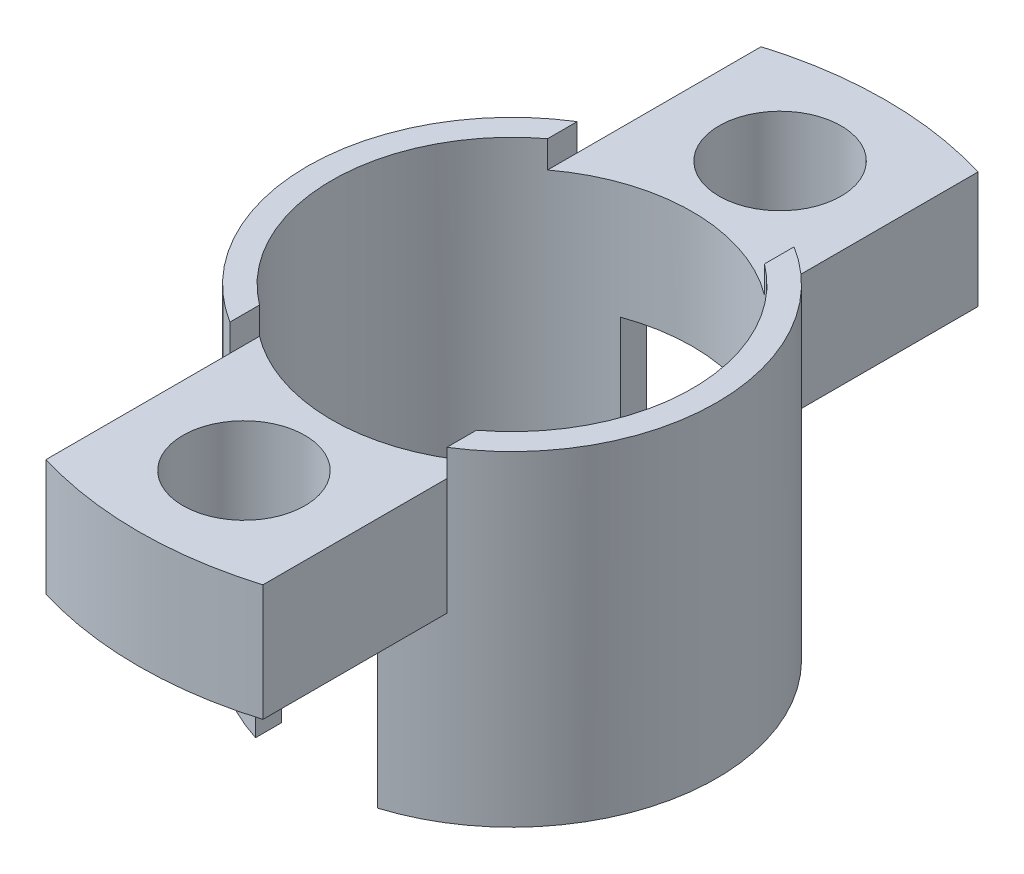
from build123d import *
from build123d.topology import SkipClean

# Parameters (mm, degrees)
SKETCH2_R                              = 6.55
SKETCH2_R_2                            = 5.8
MIDDLE_CORE_DEPTH                      = 6
ARMS_INSERT_FIXING_START               = -4.3
SKETCH3_R                              = 2.25
SKETCH3_R_2                            = 5.8
ARMS_INSERT_FIXING_TO_GUIDE_PART_DEPTH = 4.3
BOSS_EXTRU_1_REACH                     = 18.395
ESQUISSE2_R                            = 7.55
ESQUISSE2_R_2                          = 6.55
BOSS_EXTRU_2_START                     = 6
ESQUISSE3_R                            = 7.55
ESQUISSE3_R_2                          = 6.65
BOSS_EXTRU_2_DEPTH                     = 6
CUT_EXTRUDE3_START                     = -6.7
SKETCH26_W                             = 4.5
SKETCH26_H                             = 19.773523992
CUT_EXTRUDE3_DEPTH                     = 6.7
BOSS_EXTRUDE2_START                    = -1
SKETCH27_R                             = 7.55
SKETCH27_R_2                           = 6.55
BOSS_EXTRUDE2_DEPTH                    = 1
SKETCH28_W                             = 8
SKETCH28_H                             = 17.546667572
CUT_EXTRUDE4_DEPTH                     = 1
SKETCH29_R                             = 6.65
CUT_EXTRUDE5_DEPTH                     = 10


with BuildPart() as part:
    # Sketch2 → Middle-core (new body)
    with BuildSketch(Plane(origin=(0, 0, 0), x_dir=(1, 0, 0), z_dir=(0, 1, 0))):
        with Locations(Location((0, 0, 0), (0, 0, 270))):
            Circle(SKETCH2_R)
        with Locations(Location((0, 0, 0), (0, 0, 270))):
            Circle(SKETCH2_R_2, mode=Mode.SUBTRACT)
    extrude(amount=MIDDLE_CORE_DEPTH)

    # Sketch3 → Arms_insert-Fixing to guide part (add)
    with SkipClean():  # the faces are left unmerged after this step: merging them gives an invalid solid
        with BuildSketch(Plane(origin=(0, 5, 0), x_dir=(1, 0, 0), z_dir=(0, 1, 0)).offset(ARMS_INSERT_FIXING_START)):
            with BuildLine():
                Line((-4, 5.186761996), (-4, 13.186761996))
                ThreePointArc((-4, 13.186761996), (0, 13.780083161), (4, 13.186761996))
                Line((4, 13.186761996), (4, 5.186761996))
                ThreePointArc((4, 5.186761996), (6.55, 0), (4, -5.186761996))
                Line((4, -5.186761996), (4, -13.186761996))
                ThreePointArc((4, -13.186761996), (0, -13.780083161), (-4, -13.186761996))
                Line((-4, -13.186761996), (-4, -5.186761996))
                ThreePointArc((-4, -5.186761996), (-6.55, 0), (-4, 5.186761996))
            make_face()
            with Locations(Location((0, 9.886761996, 0), (0, 0, 270))):
                Circle(SKETCH3_R, mode=Mode.SUBTRACT)
            with Locations(Location((0, 0, 0), (0, 0, 270))):
                Circle(SKETCH3_R_2, mode=Mode.SUBTRACT)
            with Locations(Location((0, -9.886761996, 0), (0, 0, 270))):
                Circle(SKETCH3_R, mode=Mode.SUBTRACT)
        extrude(amount=ARMS_INSERT_FIXING_TO_GUIDE_PART_DEPTH)

    # Boss.-Extru.1: up to this face of the body (flat: up to its plane)
    boss_extru_1_end = Plane(part.part.faces().sort_by_distance((0, 5, -6.667407482))[0])
    # Esquisse2 → Boss.-Extru.1 (add, up to the picked face)
    with BuildSketch(Plane.XZ, mode=Mode.PRIVATE) as boss_extru_1_sk1:
        with Locations(Location((0, 0, 0), (0, 0, 270))):
            Circle(ESQUISSE2_R)
        with Locations(Location((0, 0, 0), (0, 0, 270))):
            Circle(ESQUISSE2_R_2, mode=Mode.SUBTRACT)
    boss_extru_1_tool1 = split(extrude(boss_extru_1_sk1.sketch, amount=-BOSS_EXTRU_1_REACH, mode=Mode.PRIVATE), bisect_by=boss_extru_1_end, keep=Keep.BOTH, mode=Mode.PRIVATE)
    add(boss_extru_1_tool1.solids().sort_by(Axis((0, 0, 7.336454), (0, 1, 0)))[0])

    # Esquisse3 → Boss.-Extru.2 (add)
    with BuildSketch(Plane.XZ.offset(BOSS_EXTRU_2_START)):
        with Locations(Location((0, 0, 0), (0, 0, 270))):
            Circle(ESQUISSE3_R)
        with Locations(Location((0, 0, 0), (0, 0, 270))):
            Circle(ESQUISSE3_R_2, mode=Mode.SUBTRACT)
    extrude(amount=-BOSS_EXTRU_2_DEPTH)

    # Sketch26 → Cut-Extrude3 (cut)
    with BuildSketch(Plane(origin=(0, -6, 0), x_dir=(-1, 0, 0), z_dir=(0, -1, 0)).offset(CUT_EXTRUDE3_START)):
        Rectangle(SKETCH26_W, SKETCH26_H)
    extrude(amount=CUT_EXTRUDE3_DEPTH, mode=Mode.SUBTRACT)

    # Sketch27 → Boss-Extrude2 (add)
    with BuildSketch(Plane(origin=(0, 6, 0), x_dir=(1, 0, 0), z_dir=(0, 1, 0)).offset(BOSS_EXTRUDE2_START)):
        with Locations(Location((0, 0, 0), (0, 0, 72.661686976))):
            Circle(SKETCH27_R)
        Circle(SKETCH27_R_2, mode=Mode.SUBTRACT)
    extrude(amount=BOSS_EXTRUDE2_DEPTH)

    # Sketch28 → Cut-Extrude4 (cut)
    with BuildSketch(Plane(origin=(0, 6, 0), x_dir=(1, 0, 0), z_dir=(0, 1, 0))):
        Rectangle(SKETCH28_W, SKETCH28_H)
    extrude(amount=-CUT_EXTRUDE4_DEPTH, mode=Mode.SUBTRACT)

    # Sketch29 → Cut-Extrude5 (cut)
    with BuildSketch(Plane.XZ):
        with Locations(Location((0, 0, 0), (0, 0, 109.776127213))):
            Circle(SKETCH29_R)
    extrude(amount=-CUT_EXTRUDE5_DEPTH, mode=Mode.SUBTRACT)


solid = part.part
